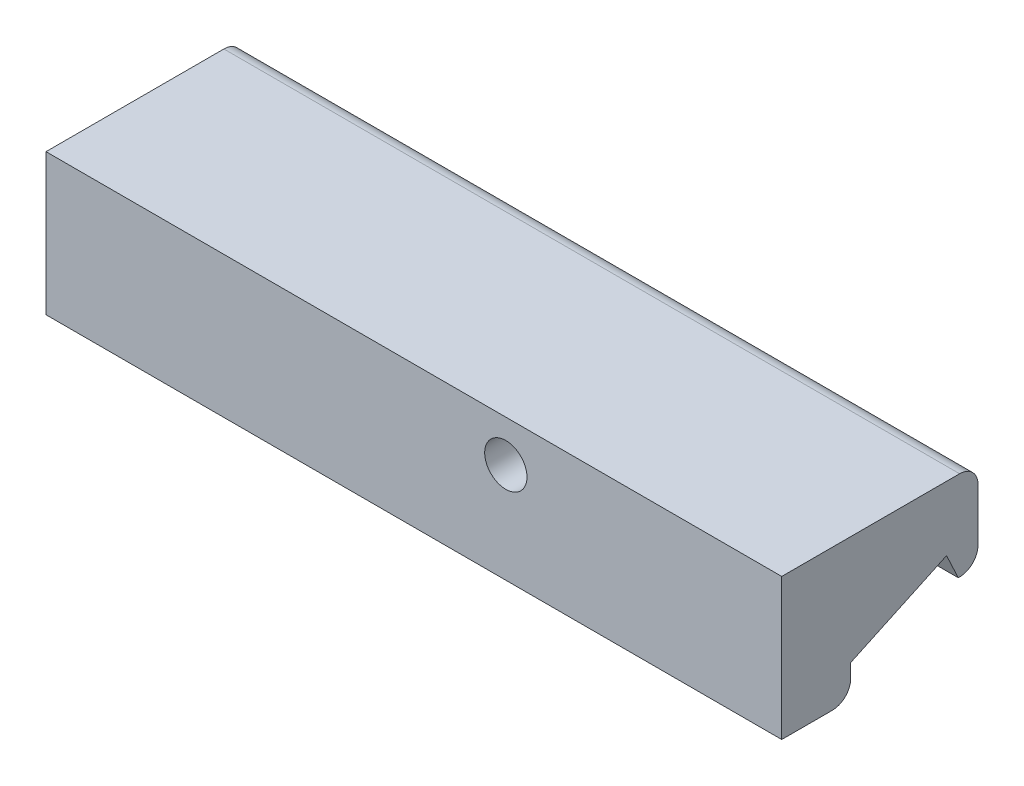
from build123d import *

# Parameters (mm, degrees)
PROFILEBOSS_EXTRUDE1_DEPTH           = 80
SKETCH2_R                            = 2.3
LEDSTRIPMOUNTHOLESCUT_EXTRUDE1_DEPTH = 4.5
SKETCH4_W                            = 28
SKETCH4_H                            = 11.5
POWERCONNECTORCUT_EXTRUDE4_DEPTH     = 6.5
SKETCH3_R                            = 2.3
MOUNTINGHOLESCUT_EXTRUDE3_DEPTH      = 4.5


with BuildPart() as part:
    # Sketch1 → ProfileBoss-Extrude1 (new body)
    with BuildSketch(Plane(origin=(0, 0, 0), x_dir=(0, 0, -1), z_dir=(1, 0, 0))):
        with BuildLine():
            Line((0, 0), (5.499461553, 0))
            ThreePointArc((5.499461553, 0), (6.914055855, 0.585944145), (7.5, 2.000538447))
            Line((7.5, 2.000538447), (7.5, 3.5))
            Line((7.5, 3.5), (17.922539551, 8.36011001))
            Line((17.922539551, 8.36011001), (19.190394336, 5.641186649))
            ThreePointArc((19.190394336, 5.641186649), (20.700753359, 6.16912635), (21.340729536, 7.635528477))
            Line((21.340729536, 7.635528477), (21.340729536, 13.36011001))
            ThreePointArc((21.340729536, 13.36011001), (20.754943098, 14.774323572), (19.340729536, 15.36011001))
            Line((19.340729536, 15.36011001), (0, 15.36011001))
            Line((0, 15.36011001), (0, 0))
        make_face()
    extrude(amount=PROFILEBOSS_EXTRUDE1_DEPTH)

    # Sketch2 → LedStripMountHolesCut-Extrude1 (cut)
    with BuildSketch(Plane(origin=(0, 0.002211655, 0.001031312), x_dir=(1, 0, 0), z_dir=(0, -0.906307787036651, -0.4226182617406973))):
        with Locations(Location((36.15, -14.026472319, 0), (0, 0, 270))):
            Circle(SKETCH2_R)
    extrude(amount=-LEDSTRIPMOUNTHOLESCUT_EXTRUDE1_DEPTH, mode=Mode.SUBTRACT)

    # Sketch4 → PowerConnectorCut-Extrude4 (cut)
    with BuildSketch(Plane(origin=(0, 0.002211655, 0.001031312), x_dir=(1, 0, 0), z_dir=(0, -0.906307787036651, -0.4226182617406973))):
        with Locations((14, -14.026472319)):
            Rectangle(SKETCH4_W, SKETCH4_H)
    extrude(amount=-POWERCONNECTORCUT_EXTRUDE4_DEPTH, mode=Mode.SUBTRACT)

    # Sketch3 → MountingHolesCut-Extrude3 (cut)
    with BuildSketch(Plane.XY):
        with Locations((50, 10.86011001)):
            Circle(SKETCH3_R)
    extrude(amount=-MOUNTINGHOLESCUT_EXTRUDE3_DEPTH, mode=Mode.SUBTRACT)


solid = part.part
